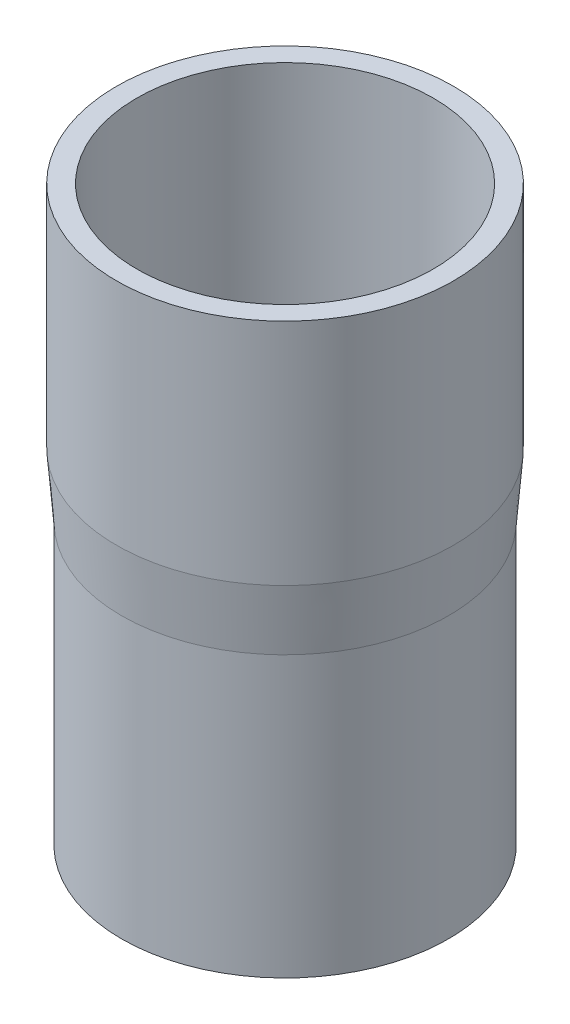
from build123d import *


with BuildPart() as part:
    # Sketch1 → Revolve1 (revolve)
    with BuildSketch(Plane.XY, mode=Mode.PRIVATE) as revolve1_sk:
        Polygon((-11.25, 0), (-12.85, 0), (-12.85, 22), (-13.25, 27), (-13.25, 45), (-11.65, 45), (-11.65, 27.063897926), (-11.25, 22.063897926), align=None)
    revolve(revolve1_sk.sketch.rotate(Axis((0, 0, 0), (0, 1, 0)), 270), axis=Axis((0, 0, 0), (0, 1, 0)))


solid = part.part
